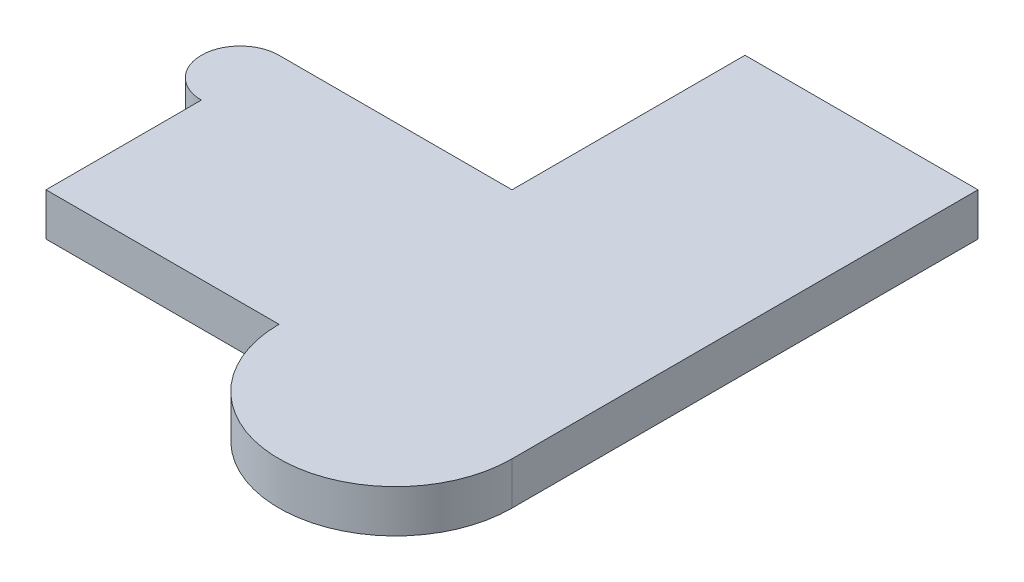
from build123d import *

# Parameters (mm, degrees)
BOSS_EXTRUDE2_DEPTH = 11


with BuildPart() as part:
    # aula 4 → Boss-Extrude2 (new body)
    with BuildSketch(Plane(origin=(0, 0, 0), x_dir=(1, 0, 0), z_dir=(0, 1, 0))):
        with BuildLine():
            Line((0, 0), (0, 60))
            Line((0, 60), (60, 60))
            Line((60, 60), (60, -60))
            ThreePointArc((60, -60), (30, -90), (0, -60))
            Line((0, -60), (-60, -60))
            Line((-60, -60), (-60, -20))
            ThreePointArc((-60, -20), (-70, -10), (-60, 0))
            Line((-60, 0), (0, 0))
        make_face()
    extrude(amount=BOSS_EXTRUDE2_DEPTH)


solid = part.part
